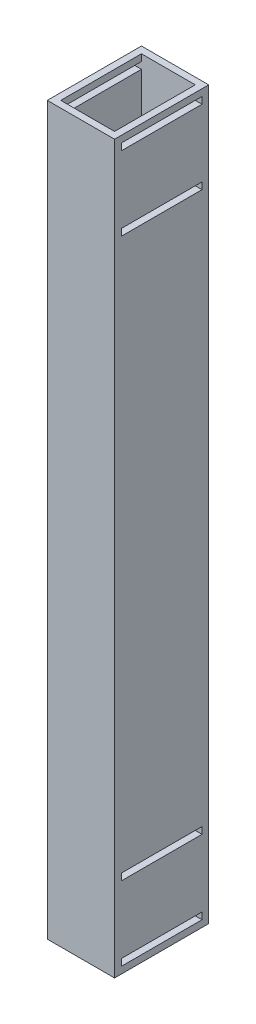
from build123d import *

# Parameters (mm, degrees)
SKETCH1_W               = 50
SKETCH1_H               = 70
BOSS_EXTRUDE1_DEPTH     = 270
SHELL1_T                = -5
CUT_EXTRUDE1_DEPTH      = 277.812210713
CUT_EXTRUDE1_DEPTH_BACK = 277.812210713
SKETCH2_W               = 5
SKETCH2_H               = 60


with BuildPart() as part:
    # Sketch1 → Boss-Extrude1 (new, symmetric)
    with BuildSketch(Plane(origin=(0, 0, 0), x_dir=(-1, 0, 0), z_dir=(0, 1, 0))):
        Rectangle(SKETCH1_W, SKETCH1_H)
    extrude(amount=BOSS_EXTRUDE1_DEPTH, both=True)

    # Shell1
    shell1_openings = [part.faces().sort_by_distance(p)[0] for p in [
        (0, 270, 0),
        (0, -270, 0),
    ]]
    offset(amount=SHELL1_T, openings=shell1_openings, kind=Kind.INTERSECTION)

    # Sketch2 → Cut-Extrude1 (cut, two sides: drawn at the far end of the back side and taken through both)
    with BuildSketch(Plane.YZ.offset(25).offset(-CUT_EXTRUDE1_DEPTH_BACK)):
        with Locations((-262.5, 0)):
            Rectangle(SKETCH2_W, SKETCH2_H)
        with Locations((-207.5, 0)):
            Rectangle(SKETCH2_W, SKETCH2_H)
        with Locations((207.5, 0)):
            Rectangle(SKETCH2_W, SKETCH2_H)
        with Locations((262.5, 0)):
            Rectangle(SKETCH2_W, SKETCH2_H)
    extrude(amount=CUT_EXTRUDE1_DEPTH + CUT_EXTRUDE1_DEPTH_BACK, mode=Mode.SUBTRACT)


solid = part.part
